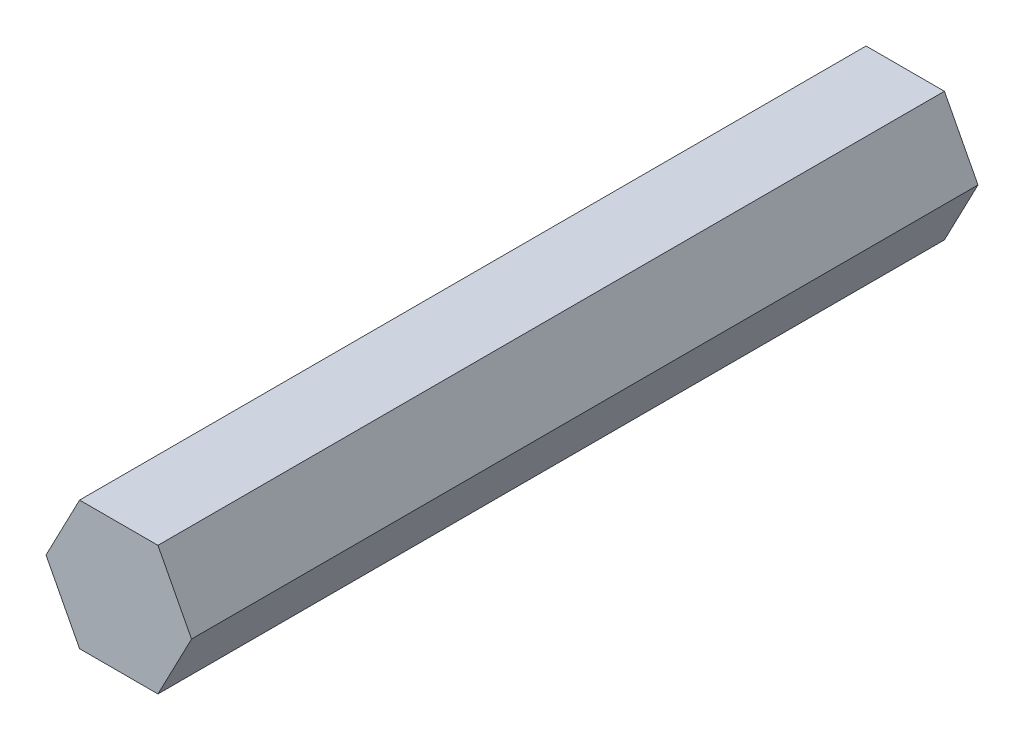
from build123d import *

# Parameters (mm, degrees)
BOSS_EXTRUDE1_DEPTH = 28.1
SKETCH2_R           = 1.5
CUT_EXTRUDE1_DEPTH  = 2


with BuildPart() as part:
    # Sketch1 → Boss-Extrude1 (new body)
    with BuildSketch(Plane.XY):
        Polygon((-1.4, 4.6), (1.4, 4.6), (2.599787383, 2.3), (1.4, 0), (-1.4, 0), (-2.599787383, 2.3), align=None)
    extrude(amount=BOSS_EXTRUDE1_DEPTH)

    # Sketch2 → Cut-Extrude1 (cut)
    with BuildSketch(Plane(origin=(0, 0, 0), x_dir=(-1, 0, 0), z_dir=(0, 0, -1))):
        with Locations((0, 2.3)):
            Circle(SKETCH2_R)
    extrude(amount=-CUT_EXTRUDE1_DEPTH, mode=Mode.SUBTRACT)


solid = part.part
